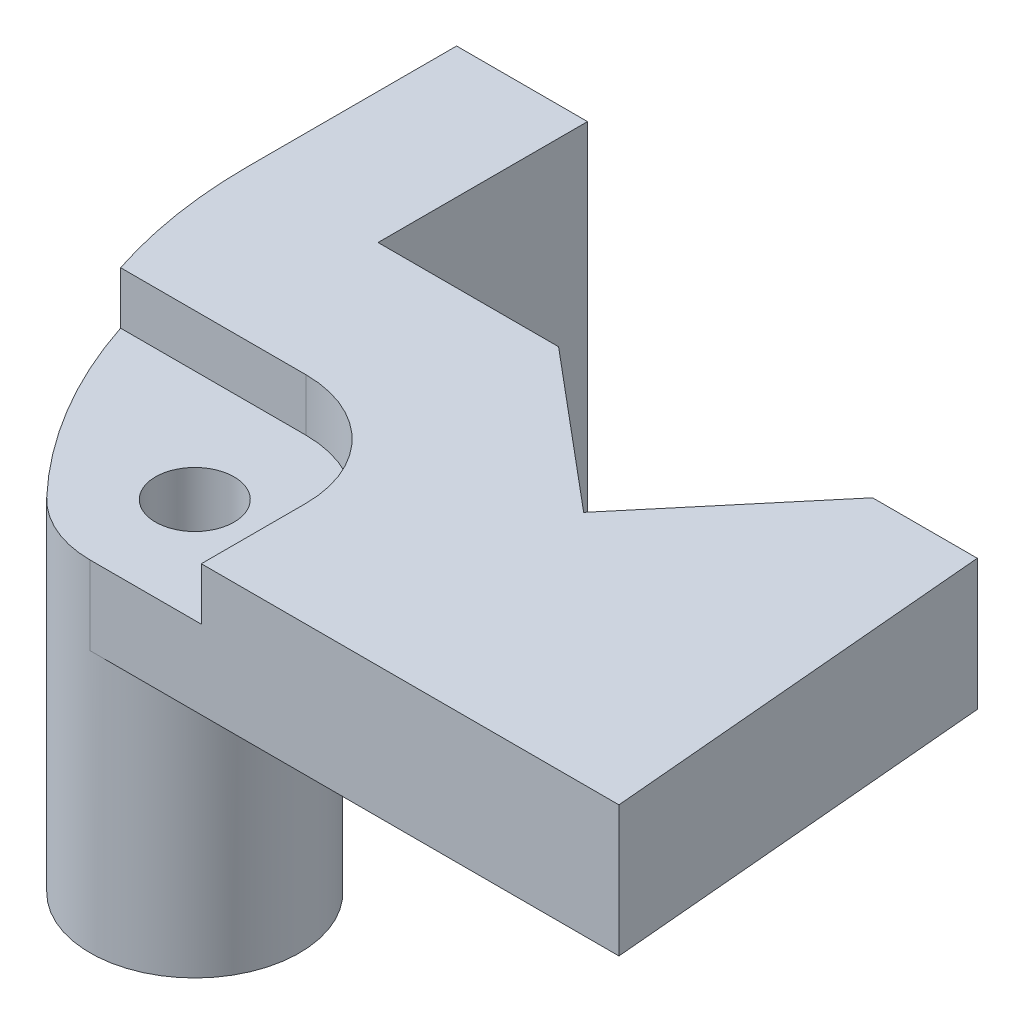
from build123d import *
from build123d.topology import SkipClean

# Parameters (mm, degrees)
SKETCH1_R           = 1.5
BOSS_EXTRUDE1_DEPTH = 5
BOSS_EXTRUDE2_START = 10
SKETCH2_R           = 1.5
BOSS_EXTRUDE2_DEPTH = 10
CUT_EXTRUDE1_DEPTH  = 2
SKETCH4_OUTSIDE_W   = 37.956
SKETCH4_OUTSIDE_H   = 31.756
SKETCH4_OUTSIDE_R   = 4
CUT_EXTRUDE2_DEPTH  = 2


with BuildPart() as part:
    # Sketch1 → Boss-Extrude1 (new body)
    with BuildSketch(Plane(origin=(0, 0, 0), x_dir=(1, 0, 0), z_dir=(0, 1, 0))):
        with BuildLine():
            Line((-11, 14), (-11, 22))
            Line((-11, 22), (-6, 22))
            Line((-6, 22), (-6, 14))
            Line((-6, 14), (0.894304297, 14))
            Line((0.894304297, 14), (6.85307226, 9))
            Line((6.85307226, 9), (11.887670047, 15))
            Line((11.887670047, 15), (15.887670047, 15))
            Line((15.887670047, 15), (17.2, 0))
            Line((17.2, 0), (-3, 0))
            ThreePointArc((-3, 0), (-4.575677194, 0.32341988), (-5.896551724, 1.24137931))
            ThreePointArc((-5.896551724, 1.24137931), (-9.676818781, 7.129272487), (-11, 14))
        make_face()
        with Locations(Location((-3, 4, 0), (0, 0, 270))):
            Circle(SKETCH1_R, mode=Mode.SUBTRACT)
    extrude(amount=BOSS_EXTRUDE1_DEPTH)

    # Sketch2 → Boss-Extrude2 (add)
    with SkipClean():  # the faces are left unmerged after this step: merging them gives an invalid solid
        with BuildSketch(Plane.XZ.offset(BOSS_EXTRUDE2_START)):
            with BuildLine():
                Line((-11, -14), (-11, -22))
                Line((-11, -22), (-6, -22))
                Line((-6, -22), (-6, -8))
                Line((-6, -8), (-3, -8))
                ThreePointArc((-3, -8), (1, -4), (-3, 0))
                ThreePointArc((-3, 0), (-4.575677194, -0.32341988), (-5.896551724, -1.24137931))
                ThreePointArc((-5.896551724, -1.24137931), (-9.676818781, -7.129272487), (-11, -14))
            make_face()
            with Locations(Location((-3, -4, 0), (0, 0, 270))):
                Circle(SKETCH2_R, mode=Mode.SUBTRACT)
        extrude(amount=-BOSS_EXTRUDE2_DEPTH)

    # Sketch3 → Cut-Extrude1 (cut)
    with SkipClean():  # the faces are left unmerged after this step: merging them gives an invalid solid
        with BuildSketch(Plane(origin=(0, 5, 0), x_dir=(1, 0, 0), z_dir=(0, 1, 0))):
            with BuildLine():
                Line((1.25, 4), (1.25, 0))
                Line((1.25, 0), (-10.083728274, 0))
                Line((-10.083728274, 0), (-10.083728274, 8.25))
                Line((-10.083728274, 8.25), (-3, 8.25))
                ThreePointArc((-3, 8.25), (0.00520382, 7.00520382), (1.25, 4))
            make_face()
        extrude(amount=-CUT_EXTRUDE1_DEPTH, mode=Mode.SUBTRACT)

    # Sketch4 outside → Cut-Extrude2 (cut)
    with SkipClean():  # the faces are left unmerged after this step: merging them gives an invalid solid
        with BuildSketch(Plane.XZ.offset(10)):
            with Locations((3.1, -11)):
                Rectangle(SKETCH4_OUTSIDE_W, SKETCH4_OUTSIDE_H)
            with Locations(Location((-3, -4, 0), (0, 0, 270))):
                Circle(SKETCH4_OUTSIDE_R, mode=Mode.SUBTRACT)
        extrude(amount=-CUT_EXTRUDE2_DEPTH, mode=Mode.SUBTRACT)


solid = part.part
